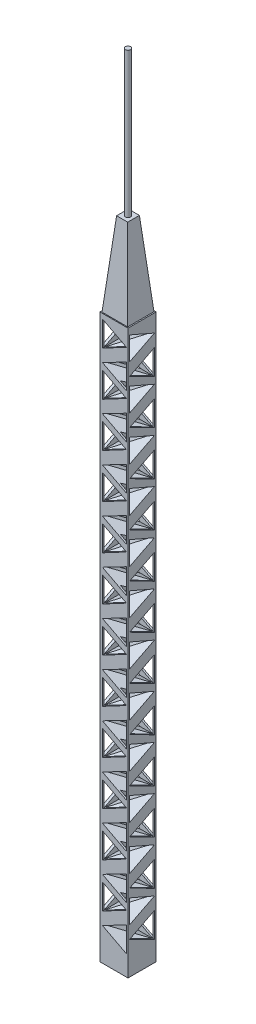
from build123d import *

# Parameters (mm, degrees)
CROQUIS1_W              = 400
CROQUIS1_H              = 400
SALIENTE_EXTRUIR1_DEPTH = 8000
CROQUIS2_W              = 364.869298106
CROQUIS2_H              = 374.138495054
SALIENTE_EXTRUIR3_DEPTH = 1186
SALIENTE_EXTRUIR3_TAPER = 5
CROQUIS5_R              = 37.1748083
SALIENTE_EXTRUIR4_DEPTH = 2061
CORTAR_EXTRUIR1_DEPTH   = 2061
MATRIZL1_COUNT          = 12
MATRIZL1_PITCH          = 630
CORTAR_EXTRUIR2_DEPTH   = 2061
MATRIZL2_COUNT          = 12
MATRIZL2_PITCH          = 630


with BuildPart() as part:
    # Croquis1 → Saliente-Extruir1 (new body)
    with BuildSketch(Plane(origin=(0, 0, 0), x_dir=(1, 0, 0), z_dir=(0, 1, 0))):
        Rectangle(CROQUIS1_W, CROQUIS1_H)
    extrude(amount=SALIENTE_EXTRUIR1_DEPTH)

    # Croquis2 → Saliente-Extruir3 (add)
    with BuildSketch(Plane(origin=(0, 8000, 0), x_dir=(1, 0, 0), z_dir=(0, 1, 0))):
        Rectangle(CROQUIS2_W, CROQUIS2_H)
    extrude(amount=SALIENTE_EXTRUIR3_DEPTH, taper=SALIENTE_EXTRUIR3_TAPER)

    # Croquis5 → Saliente-Extruir4 (add)
    with BuildSketch(Plane(origin=(0, 9186, 0), x_dir=(1, 0, 0), z_dir=(0, 1, 0))):
        with Locations(Location((0, 0, 0), (0, 0, 270))):
            Circle(CROQUIS5_R)
    extrude(amount=SALIENTE_EXTRUIR4_DEPTH)

    # Croquis6 → Cortar-Extruir1 (cut)
    with BuildSketch(Plane.XY.offset(200)):
        Polygon((-163.278927938, 7931.18647475), (-163.278927938, 7572.19355431), (178.022481763, 7753.322811212), align=None)
        Polygon((178.022481763, 7572.19355431), (178.022481763, 7216.748682562), (-163.278927938, 7394.471118436), align=None)
    cortar_extruir1 = extrude(amount=-CORTAR_EXTRUIR1_DEPTH, mode=Mode.SUBTRACT)

    # MatrizL1: Cortar-Extruir1 ×12
    with Locations(*[(0, -i * MATRIZL1_PITCH, 0) for i in range(1, MATRIZL1_COUNT)]):
        add(cortar_extruir1, mode=Mode.SUBTRACT)

    # Croquis7 → Cortar-Extruir2 (cut)
    with BuildSketch(Plane.ZY.offset(200)):
        Polygon((-175.574568491, 7573.40534849), (-175.574568491, 7216.175456925), (176.541090068, 7394.790402707), align=None)
        Polygon((-175.574568491, 7751.69001453), (176.541090068, 7904.58520289), (176.541090068, 7573.40534849), align=None)
    cortar_extruir2 = extrude(amount=-CORTAR_EXTRUIR2_DEPTH, mode=Mode.SUBTRACT)

    # MatrizL2: Cortar-Extruir2 ×12
    with Locations(*[(0, -i * MATRIZL2_PITCH, 0) for i in range(1, MATRIZL2_COUNT)]):
        add(cortar_extruir2, mode=Mode.SUBTRACT)


solid = part.part
